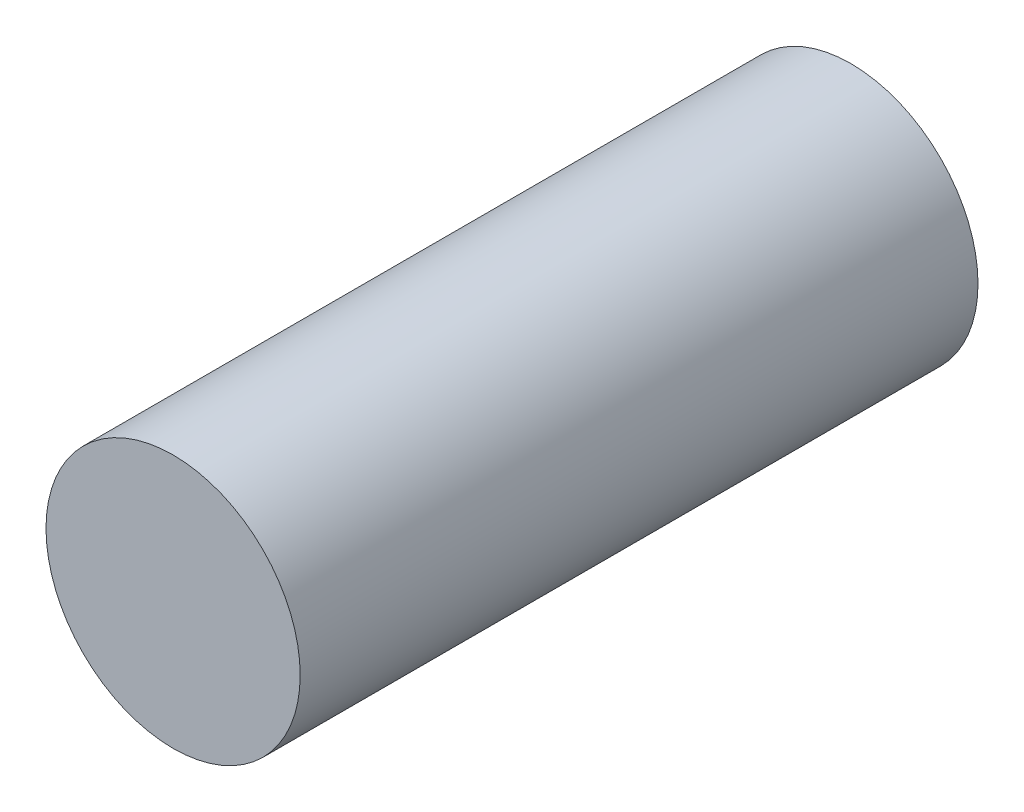
from build123d import *

# Parameters (mm, degrees)
SKETCH1_R           = 7.5
BOSS_EXTRUDE1_DEPTH = 40


with BuildPart() as part:
    # Sketch1 → Boss-Extrude1 (new body)
    with BuildSketch(Plane.XY):
        Circle(SKETCH1_R)
    extrude(amount=BOSS_EXTRUDE1_DEPTH)


solid = part.part
